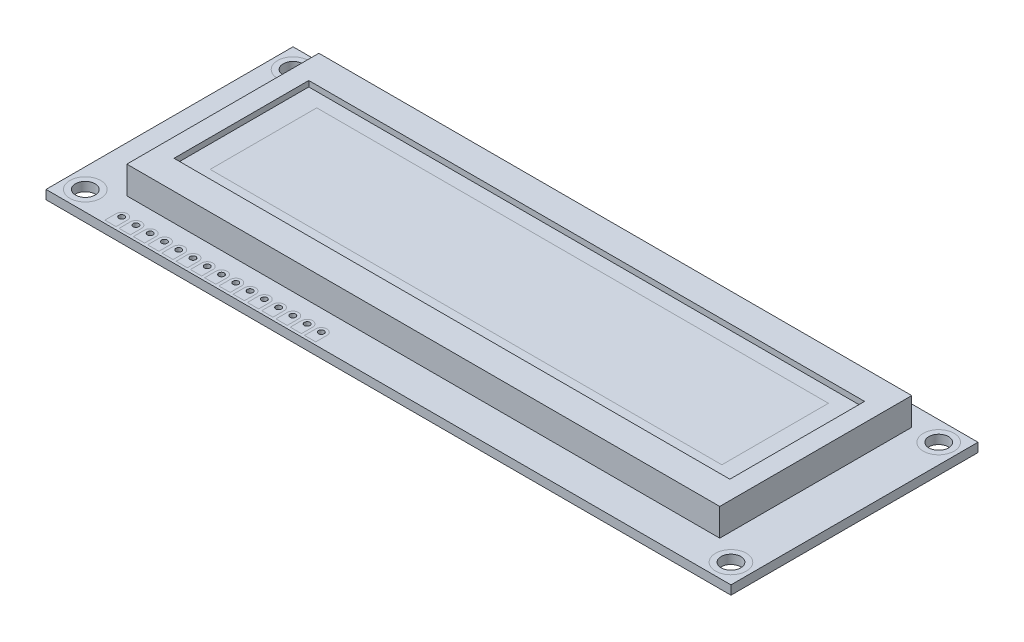
from build123d import *

# Parameters (mm, degrees)
SKETCH1_W           = 122
SKETCH1_H           = 44
BOSS_EXTRUDE1_DEPTH = 1.6
SKETCH2_W           = 105.6
SKETCH2_H           = 34.2
BOSS_EXTRUDE2_DEPTH = 4.9
SKETCH3_R           = 1.75
CUT_EXTRUDE1_DEPTH  = 66.030838838
SKETCH5_W           = 99
SKETCH5_H           = 24
CUT_EXTRUDE2_DEPTH  = 1
SKETCH4_R           = 0.5
CUT_EXTRUDE3_DEPTH  = 66.030838838
LPATTERN1_COUNT     = 15
LPATTERN1_PITCH     = 2.54


with BuildPart() as part:
    # Sketch1 → Boss-Extrude1 (new body)
    with BuildSketch(Plane(origin=(0, 0, 0), x_dir=(1, 0, 0), z_dir=(0, 1, 0))):
        Rectangle(SKETCH1_W, SKETCH1_H)
    extrude(amount=BOSS_EXTRUDE1_DEPTH)

    # Sketch2 → Boss-Extrude2 (add)
    with BuildSketch(Plane(origin=(0, 1.6, 0), x_dir=(1, 0, 0), z_dir=(0, 1, 0))):
        with Locations((0, 1.3)):
            Rectangle(SKETCH2_W, SKETCH2_H)
    extrude(amount=BOSS_EXTRUDE2_DEPTH)

    # Sketch3 → Cut-Extrude1 (cut, through all)
    with BuildSketch(Plane(origin=(0, 1.6, 0), x_dir=(1, 0, 0), z_dir=(0, 1, 0))):
        with Locations((-57.5, 18.5)):
            Circle(SKETCH3_R)
        with Locations((-57.5, -18.5)):
            Circle(SKETCH3_R)
        with Locations((57.5, 18.5)):
            Circle(SKETCH3_R)
        with Locations((57.5, -18.5)):
            Circle(SKETCH3_R)
    extrude(amount=-CUT_EXTRUDE1_DEPTH, mode=Mode.SUBTRACT)

    # Sketch5 → Cut-Extrude2 (cut)
    with BuildSketch(Plane(origin=(0, 6.5, 0), x_dir=(1, 0, 0), z_dir=(0, 1, 0))):
        with Locations((0, 1.3)):
            Rectangle(SKETCH5_W, SKETCH5_H)
    extrude(amount=-CUT_EXTRUDE2_DEPTH, mode=Mode.SUBTRACT)

    # Sketch4 → Cut-Extrude3 (cut, through all)
    with BuildSketch(Plane(origin=(0, 1.6, 0), x_dir=(1, 0, 0), z_dir=(0, 1, 0))):
        with Locations((-50.02, -19.5)):
            Circle(SKETCH4_R)
    cut_extrude3 = extrude(amount=-CUT_EXTRUDE3_DEPTH, mode=Mode.SUBTRACT)

    # LPattern1: Cut-Extrude3 ×15
    with Locations(*[(i * LPATTERN1_PITCH, 0, 0) for i in range(1, LPATTERN1_COUNT)]):
        add(cut_extrude3, mode=Mode.SUBTRACT)


solid = part.part
